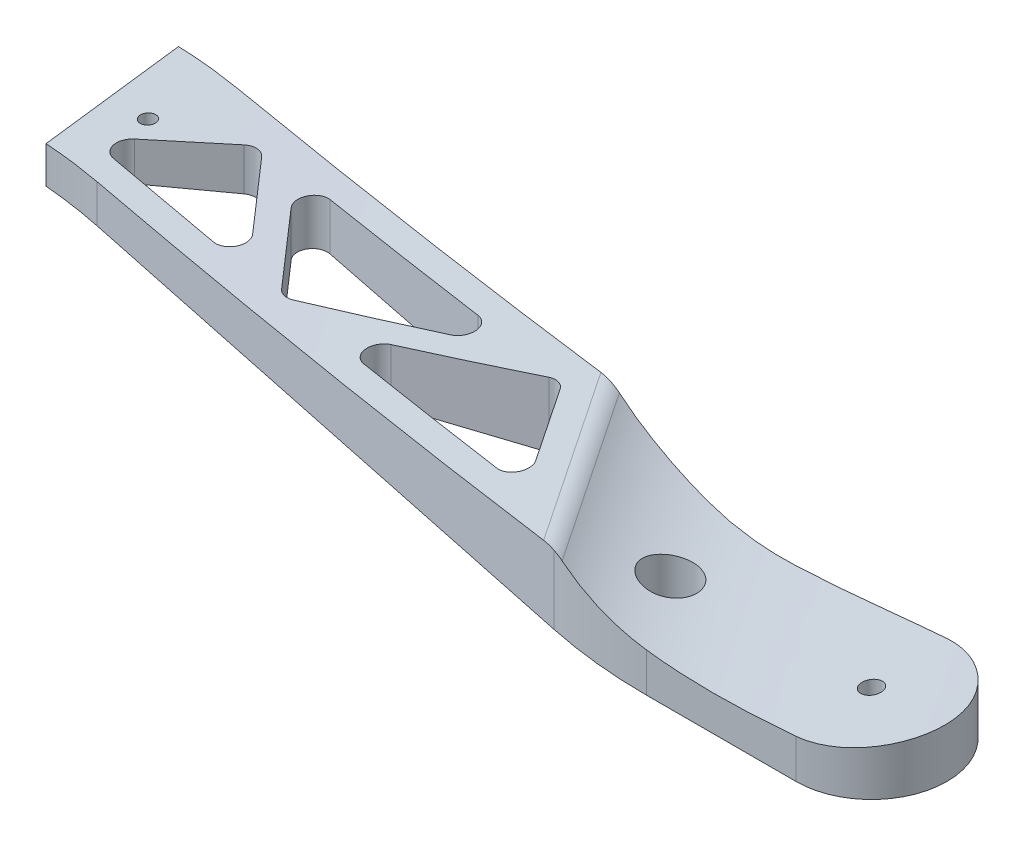
from build123d import *

# Parameters (mm, degrees)
SKETCH1_R               = 5
SKETCH1_R_2             = 2
BOSS_EXTRUDE1_DEPTH     = 20
FILLET1_R               = 100
CUT_EXTRUDE3_DEPTH      = 300
CUT_EXTRUDE3_DEPTH_BACK = 131
FILLET3_R               = 5
SKETCH4_R               = 1.5
CUT_EXTRUDE4_DEPTH      = 114
FILLET4_R               = 3
CUT_EXTRUDE5_DEPTH      = 133


with BuildPart() as part:
    # Sketch1 → Boss-Extrude1 (new body)
    with BuildSketch(Plane(origin=(0, 0, 0), x_dir=(1, 0, 0), z_dir=(0, 1, 0))):
        with BuildLine():
            Line((0, 15), (-139.784941349, 43.225909045))
            Line((-139.784941349, 43.225909045), (-351.875415017, 29.941322925))
            ThreePointArc((-351.875415017, 29.941322925), (-378.412739548, -9.628926804), (-333.285739517, -24.912516864))
            Line((-333.285739517, -24.912516864), (-287.823465989, 5.588948968))
            Line((-287.823465989, 5.588948968), (-138.053278996, 13.889014505))
            Line((-138.053278996, 13.889014505), (-5.919683, -13.782501703))
            Line((-5.919683, -13.782501703), (0, -15))
            Line((0, -15), (40, -15))
            ThreePointArc((40, -15), (55, 0), (40, 15))
            Line((40, 15), (0, 15))
        make_face()
        with Locations(Location((0, 0, 0), (0, 0, 270))):
            Circle(SKETCH1_R, mode=Mode.SUBTRACT)
        with Locations(Location((40, 0, 0), (0, 0, 270))):
            Circle(SKETCH1_R_2, mode=Mode.SUBTRACT)
    extrude(amount=BOSS_EXTRUDE1_DEPTH)

    # Fillet1
    fillet1_edges = [part.edges().sort_by_distance(p)[0] for p in [
        (0, 10, -15),
        (-139.784941349, 10, -43.225909045),
        (-138.053278996, 10, -13.889014505),
        (-287.823465989, 10, -5.588948968),
        (0, 10, 15),
    ]]
    fillet(fillet1_edges, radius=FILLET1_R)

    # Sketch3 → Cut-Extrude3 (cut, two sides: drawn at the far end of the back side and taken through both)
    with BuildSketch(Plane(origin=(-86.356848498, 0, -128.714426022), x_dir=(0.8304172287941746, 0, -0.557142016116002), z_dir=(0.557142016116002, 0, 0.8304172287941746)).offset(-CUT_EXTRUDE3_DEPTH_BACK)):
        with BuildLine():
            Line((0.156842574, 20), (-290.646030078, 20))
            add(Edge.make_bspline(
                [(-290.646030078, 20), (-152.53466, -2.539392014), (-15.681609056, 14)],
                knots=[0, 0, 0, 1, 1, 1], degree=2))
            add(Edge.make_bspline(
                [(-15.681609056, 14), (1.778655923, 1.080988316), (32.031463633, 10), (48.216689152, 10)],
                knots=[0, 0, 0, 0, 1, 1, 1, 1], degree=3))
            Line((48.216689152, 10), (48.216689152, 20))
            Line((48.216689152, 20), (0.156842574, 20))
        make_face()
    extrude(amount=CUT_EXTRUDE3_DEPTH + CUT_EXTRUDE3_DEPTH_BACK, mode=Mode.SUBTRACT)

    # Fillet3
    fillet3_edges = [part.edges().sort_by_distance(p)[0] for p in [
        (-21.864392185, 14, -4.442240649),
    ]]
    fillet(fillet3_edges, radius=FILLET3_R)

    # Sketch4 → Cut-Extrude4 (cut)
    with BuildSketch(Plane(origin=(0, 0, 0), x_dir=(1, 0, 0), z_dir=(0, 1, 0))):
        with Locations(Location((-147.336246923, 28.050603479, 0), (0, 0, 90))):
            Circle(SKETCH4_R)
        with Locations(Location((-130.791911053, 26.905656844, 0), (0, 0, 90))):
            Circle(SKETCH4_R)
        with Locations(Location((-364.746711272, 9.415773639, 0), (0, 0, 270))):
            Circle(SKETCH4_R)
        with Locations(Location((-348.032450789, -15.496743225, 0), (0, 0, 270))):
            Circle(SKETCH4_R)
        Polygon((-23.866128519, -4.915677567), (-39.103088127, 17.794930154), (-75.639684705, 5.926779178), align=None)
        Polygon((-49.0834237, 19.810197617), (-105.838380632, 31.270375206), (-85.479969978, 7.987539058), align=None)
        Polygon((-113.9043748, 32.899091544), (-93.610691693, 9.690280862), (-134.183540545, 18.187077125), align=None)
        Polygon((-143.989822428, 18.567691314), (-162.24368626, 36.809375165), (-173.639207374, 16.924561642), align=None)
        Polygon((-168.221096355, 36.434971648), (-179.591082035, 16.594716626), (-198.135268167, 34.561255282), align=None)
        Polygon((-186.387937739, 16.218043878), (-204.884563485, 34.138503645), (-219.662547376, 14.374009052), align=None)
        Polygon((-211.434434242, 33.728243247), (-226.175542257, 14.013067496), (-242.935285915, 31.755142949), align=None)
        Polygon((-232.71148459, 13.650854223), (-279.687517615, 11.047504647), (-249.429154901, 31.348390301), align=None)
        Polygon((-259.327642719, 30.728384548), (-327.767277309, -15.189010559), (-354.571570516, 24.762646722), align=None)
    extrude(amount=CUT_EXTRUDE4_DEPTH, mode=Mode.SUBTRACT)

    # Fillet4
    fillet4_edges = [part.edges().sort_by_distance(p)[0] for p in [
        (-23.866128519, 6.59687861, 4.915677567),
        (-75.639684705, 4.853769064, -5.926779178),
        (-39.103088127, 6.59687861, -17.794930154),
        (-49.0834237, 6.203132148, -19.810197617),
        (-85.479969978, 4.603063185, -7.987539058),
        (-105.838380632, 4.473862314, -31.270375206),
        (-93.610691693, 4.415303992, -9.690280862),
        (-134.183540545, 3.740248049, -18.187077125),
        (-113.9043748, 4.298352255, -32.899091544),
        (-143.989822428, 3.631366763, -18.567691314),
        (-173.639207374, 3.502352989, -16.924561642),
        (-162.24368626, 3.579543024, -36.809375165),
        (-179.591082035, 3.517150778, -16.594716626),
        (-198.135268167, 3.547363849, -34.561255282),
        (-168.221096355, 3.539514704, -36.434971648),
        (-204.884563485, 3.597054187, -34.138503645),
        (-186.387937739, 3.550671331, -16.218043878),
        (-219.662547376, 3.97020999, -14.374009052),
        (-242.935285915, 4.206596653, -31.755142949),
        (-226.175542257, 4.101905497, -14.013067496),
        (-211.434434242, 3.662123803, -33.728243247),
        (-279.687517615, 5.796823139, -11.047504647),
        (-232.71148459, 4.250360261, -13.650854223),
        (-249.429154901, 4.366437166, -31.348390301),
        (-259.327642719, 4.641338109, -30.728384548),
        (-354.571570516, 9.209496695, -24.762646722),
        (-327.767277309, 9.209496695, 15.189010559),
    ]]
    fillet(fillet4_edges, radius=FILLET4_R)

    # Sketch5 → Cut-Extrude5 (cut)
    with BuildSketch(Plane(origin=(0, 0, 0), x_dir=(1, 0, 0), z_dir=(0, 1, 0))):
        Polygon((-149.587638653, 131.717060473), (-120.561512139, -144.448085883), (-303.389361638, -167.783578065), (-434.641340231, 42.403156887), align=None)
    extrude(amount=CUT_EXTRUDE5_DEPTH, mode=Mode.SUBTRACT)


solid = part.part
